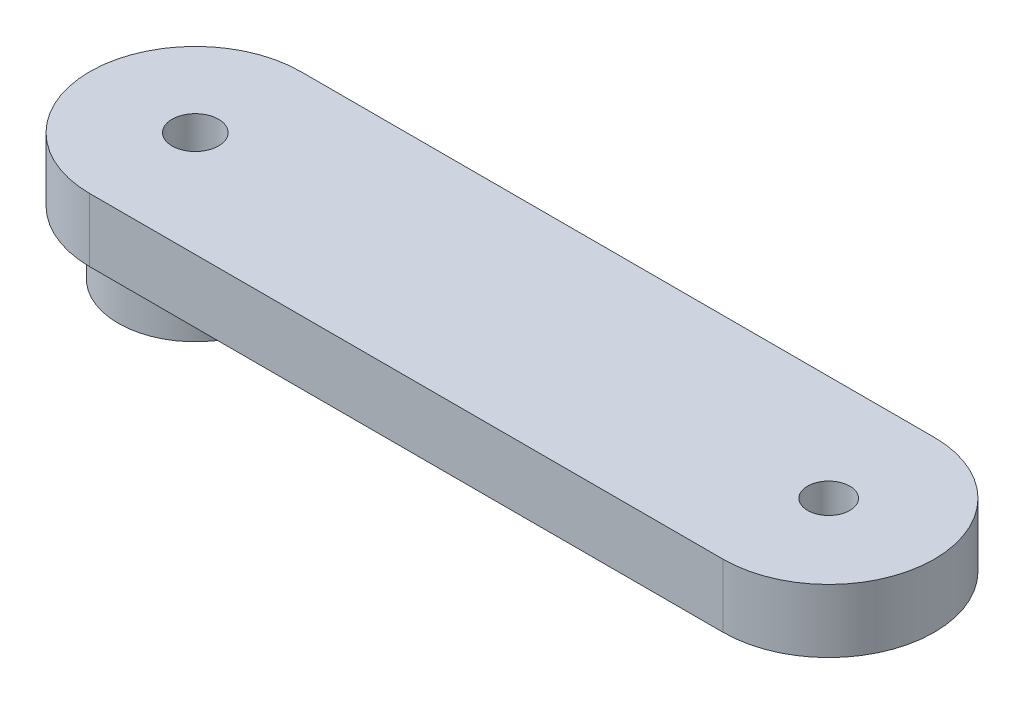
from build123d import *

# Parameters (mm, degrees)
BOSS_EXTRUDE1_DEPTH = 3
SKETCH2_R           = 3.65
BOSS_EXTRUDE2_DEPTH = 3
SKETCH3_R           = 1.1
CUT_EXTRUDE1_DEPTH  = 6
SKETCH5_R           = 2.65
CUT_EXTRUDE2_DEPTH  = 4
SKETCH7_R           = 1
CUT_EXTRUDE4_DEPTH  = 3


with BuildPart() as part:
    # Sketch1 → Boss-Extrude1 (new body)
    with BuildSketch(Plane(origin=(0, 0, 0), x_dir=(1, 0, 0), z_dir=(0, 1, 0))):
        with BuildLine():
            Line((0, 5), (30, 5))
            ThreePointArc((30, 5), (35, 0), (30, -5))
            Line((30, -5), (0, -5))
            ThreePointArc((0, -5), (-5, 0), (0, 5))
        make_face()
    extrude(amount=BOSS_EXTRUDE1_DEPTH)

    # Sketch2 → Boss-Extrude2 (add)
    with BuildSketch(Plane.XZ):
        with Locations(Location((0, 0, 0), (0, 0, 90))):
            Circle(SKETCH2_R)
    extrude(amount=BOSS_EXTRUDE2_DEPTH)

    # Sketch3 → Cut-Extrude1 (cut)
    with BuildSketch(Plane.XZ.offset(3)):
        with Locations(Location((0, 0, 0), (0, 0, 270))):
            Circle(SKETCH3_R)
    extrude(amount=-CUT_EXTRUDE1_DEPTH, mode=Mode.SUBTRACT)

    # Sketch5 → Cut-Extrude2 (cut)
    with BuildSketch(Plane.XZ.offset(3)):
        with Locations(Location((0, 0, 0), (0, 0, 270))):
            Circle(SKETCH5_R)
    extrude(amount=-CUT_EXTRUDE2_DEPTH, mode=Mode.SUBTRACT)

    # Sketch7 → Cut-Extrude4 (cut)
    with BuildSketch(Plane(origin=(0, 3, 0), x_dir=(1, 0, 0), z_dir=(0, 1, 0))):
        with Locations(Location((30, 0, 0), (0, 0, 270))):
            Circle(SKETCH7_R)
    extrude(amount=-CUT_EXTRUDE4_DEPTH, mode=Mode.SUBTRACT)


solid = part.part
